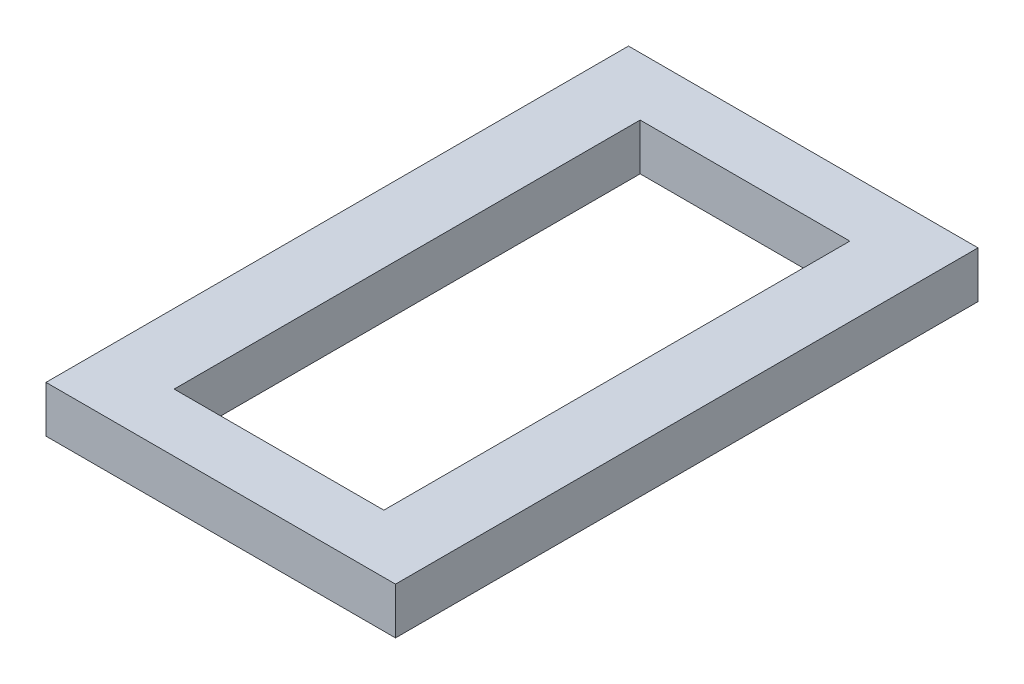
from build123d import *

# Parameters (mm, degrees)
SKETCH1_W           = 45
SKETCH1_H           = 75
SKETCH1_W_2         = 27
SKETCH1_H_2         = 60
BOSS_EXTRUDE1_DEPTH = 6


with BuildPart() as part:
    # Sketch1 → Boss-Extrude1 (new body)
    with BuildSketch(Plane(origin=(0, 0, 0), x_dir=(1, 0, 0), z_dir=(0, 1, 0))):
        Rectangle(SKETCH1_W, SKETCH1_H)
        Rectangle(SKETCH1_W_2, SKETCH1_H_2, mode=Mode.SUBTRACT)
    extrude(amount=BOSS_EXTRUDE1_DEPTH)


solid = part.part
